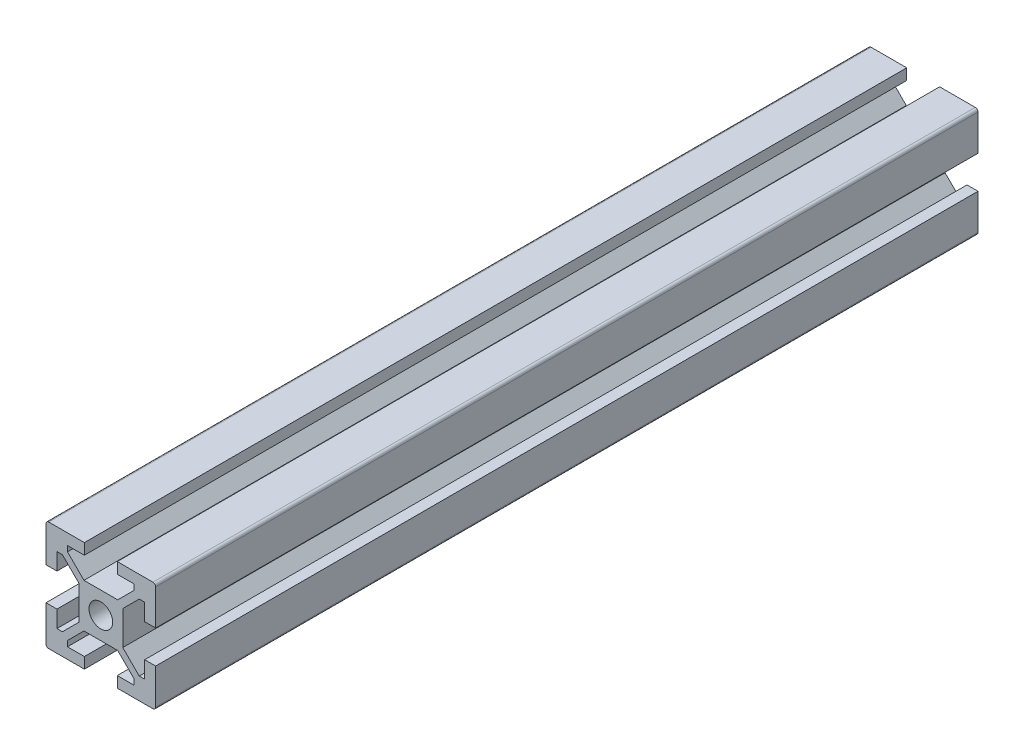
from build123d import *

# Parameters (mm, degrees)
SKETCH1_R           = 2.15
BOSS_EXTRUDE1_DEPTH = 150


with BuildPart() as part:
    # Sketch1 → Boss-Extrude1 (new body)
    with BuildSketch(Plane.XY):
        with BuildLine():
            Line((-3, 10), (-9.5, 10))
            ThreePointArc((-9.5, 10), (-9.853553391, 9.853553391), (-10, 9.5))
            Line((-10, 9.5), (-10, 3))
            Line((-10, 3), (-8, 3))
            Line((-8, 3), (-8, 6.080761184))
            Line((-8, 6.080761184), (-7, 6.080761184))
            Line((-7, 6.080761184), (-4, 3.080761184))
            Line((-4, 3.080761184), (-4, -3.080761184))
            Line((-4, -3.080761184), (-7, -6.080761184))
            Line((-7, -6.080761184), (-8, -6.080761184))
            Line((-8, -6.080761184), (-8, -3))
            Line((-8, -3), (-10, -3))
            Line((-10, -3), (-10, -9.5))
            ThreePointArc((-10, -9.5), (-9.853553391, -9.853553391), (-9.5, -10))
            Line((-9.5, -10), (-3, -10))
            Line((-3, -10), (-3, -8))
            Line((-3, -8), (-6.080761184, -8))
            Line((-6.080761184, -8), (-6.080761184, -7))
            Line((-6.080761184, -7), (-3.080761184, -4))
            Line((-3.080761184, -4), (3.080761184, -4))
            Line((3.080761184, -4), (6.080761184, -7))
            Line((6.080761184, -7), (6.080761184, -8))
            Line((6.080761184, -8), (3, -8))
            Line((3, -8), (3, -10))
            Line((3, -10), (9.5, -10))
            ThreePointArc((9.5, -10), (9.853553391, -9.853553391), (10, -9.5))
            Line((10, -9.5), (10, -3))
            Line((10, -3), (8, -3))
            Line((8, -3), (8, -6.080761184))
            Line((8, -6.080761184), (7, -6.080761184))
            Line((7, -6.080761184), (4, -3.080761184))
            Line((4, -3.080761184), (4, 3.080761184))
            Line((4, 3.080761184), (7, 6.080761184))
            Line((7, 6.080761184), (8, 6.080761184))
            Line((8, 6.080761184), (8, 3))
            Line((8, 3), (10, 3))
            Line((10, 3), (10, 9.5))
            ThreePointArc((10, 9.5), (9.853553391, 9.853553391), (9.5, 10))
            Line((9.5, 10), (3, 10))
            Line((3, 10), (3, 8))
            Line((3, 8), (6.080761184, 8))
            Line((6.080761184, 8), (6.080761184, 7))
            Line((6.080761184, 7), (3.080761184, 4))
            Line((3.080761184, 4), (-3.080761184, 4))
            Line((-3.080761184, 4), (-6.080761184, 7))
            Line((-6.080761184, 7), (-6.080761184, 8))
            Line((-6.080761184, 8), (-3, 8))
            Line((-3, 8), (-3, 10))
        make_face()
        Circle(SKETCH1_R, mode=Mode.SUBTRACT)
    extrude(amount=BOSS_EXTRUDE1_DEPTH)


solid = part.part
